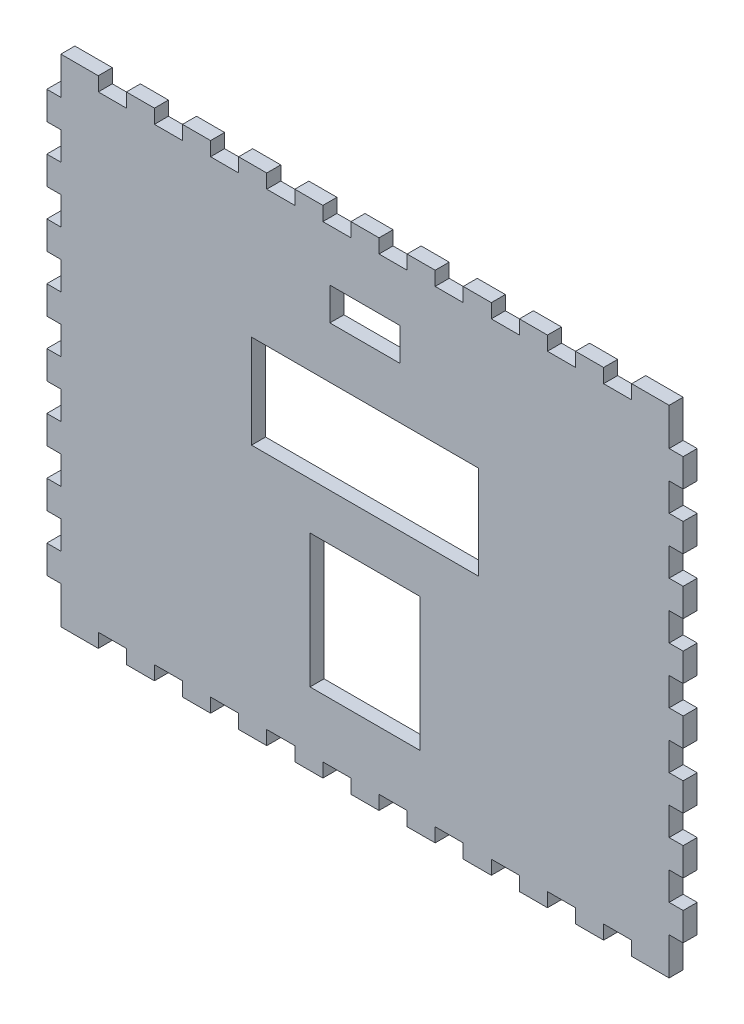
from build123d import *

# Parameters (mm, degrees)
BOSS_EXTRUDE1_DEPTH = 6
SKETCH2_W           = 30
SKETCH2_H           = 14
SKETCH2_W_2         = 97
SKETCH2_H_2         = 40
SKETCH2_W_3         = 47
SKETCH2_H_3         = 57
CUT_EXTRUDE1_DEPTH  = 6


with BuildPart() as part:
    # Model → Boss-Extrude1 (new body)
    with BuildSketch(Plane.XY):
        Polygon((221, 430), (221, 414), (215, 414), (215, 402), (221, 402), (221, 390), (215, 390), (215, 378), (221, 378), (221, 366), (215, 366), (215, 354), (221, 354), (221, 342), (215, 342), (215, 330), (221, 330), (221, 318), (215, 318), (215, 306), (221, 306), (221, 294), (215, 294), (215, 282), (221, 282), (221, 270), (215, 270), (215, 258), (221, 258), (221, 246), (215, 246), (215, 234), (221, 234), (221, 218), (237, 218), (237, 224), (249, 224), (249, 218), (261, 218), (261, 224), (273, 224), (273, 218), (285, 218), (285, 224), (297, 224), (297, 218), (309, 218), (309, 224), (321, 224), (321, 218), (333, 218), (333, 224), (345, 224), (345, 218), (357, 218), (357, 224), (369, 224), (369, 218), (381, 218), (381, 224), (393, 224), (393, 218), (405, 218), (405, 224), (417, 224), (417, 218), (429, 218), (429, 224), (441, 224), (441, 218), (453, 218), (453, 224), (465, 224), (465, 218), (477, 218), (481, 218), (481, 234), (487, 234), (487, 246), (481, 246), (481, 258), (487, 258), (487, 270), (481, 270), (481, 282), (487, 282), (487, 294), (481, 294), (481, 306), (487, 306), (487, 318), (481, 318), (481, 330), (487, 330), (487, 342), (481, 342), (481, 354), (487, 354), (487, 366), (481, 366), (481, 378), (487, 378), (487, 390), (481, 390), (481, 402), (487, 402), (487, 414), (481, 414), (481, 430), (465, 430), (465, 424), (453, 424), (453, 430), (441, 430), (441, 424), (429, 424), (429, 430), (417, 430), (417, 424), (405, 424), (405, 430), (393, 430), (393, 424), (381, 424), (381, 430), (369, 430), (369, 424), (357, 424), (357, 430), (345, 430), (345, 424), (333, 424), (333, 430), (321, 430), (321, 424), (309, 424), (309, 430), (297, 430), (297, 424), (285, 424), (285, 430), (273, 430), (273, 424), (261, 424), (261, 430), (249, 430), (249, 424), (237, 424), (237, 430), (225, 430), align=None)
    extrude(amount=BOSS_EXTRUDE1_DEPTH)

    # Sketch2 → Cut-Extrude1 (cut)
    with BuildSketch(Plane.XY.offset(6)):
        with Locations((351, 395)):
            Rectangle(SKETCH2_W, SKETCH2_H)
        with Locations((351, 346)):
            Rectangle(SKETCH2_W_2, SKETCH2_H_2)
        with Locations((351, 277.5)):
            Rectangle(SKETCH2_W_3, SKETCH2_H_3)
    extrude(amount=-CUT_EXTRUDE1_DEPTH, mode=Mode.SUBTRACT)


solid = part.part
